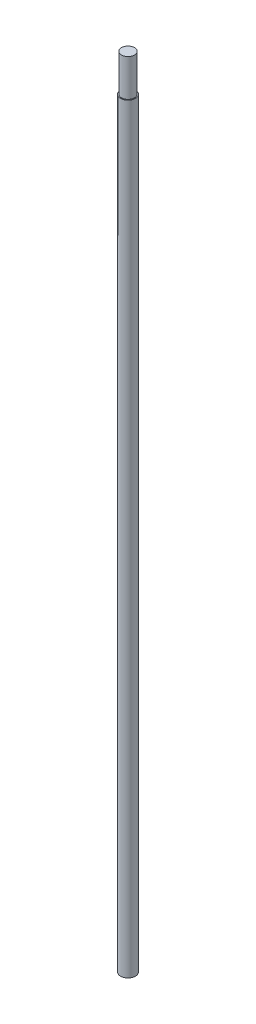
from build123d import *

# Parameters (mm, degrees)
ESQUISSE1_R        = 4
BOSS_EXTRU_1_DEPTH = 410
ESQUISSE2_R        = 3.5
BOSS_EXTRU_2_DEPTH = 20


with BuildPart() as part:
    # Esquisse1 → Boss.-Extru.1 (new body)
    with BuildSketch(Plane(origin=(0, 0, 0), x_dir=(1, 0, 0), z_dir=(0, 1, 0))):
        with Locations(Location((0, 0, 0), (0, 0, 90))):
            Circle(ESQUISSE1_R)
    extrude(amount=BOSS_EXTRU_1_DEPTH)

    # Esquisse2 → Boss.-Extru.2 (add)
    with BuildSketch(Plane(origin=(0, 410, 0), x_dir=(1, 0, 0), z_dir=(0, 1, 0))):
        with Locations(Location((0, 0, 0), (0, 0, 270))):
            Circle(ESQUISSE2_R)
    extrude(amount=BOSS_EXTRU_2_DEPTH)


solid = part.part
